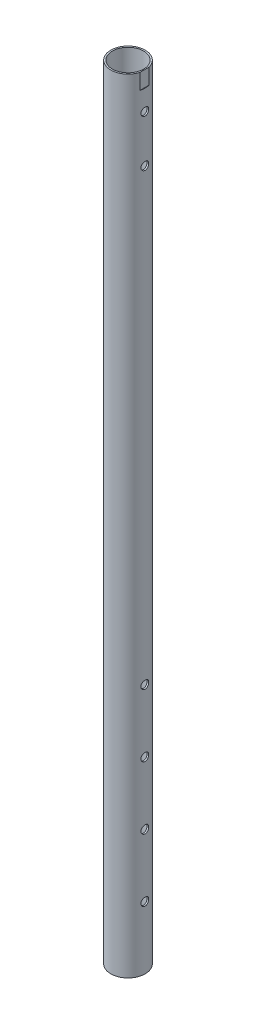
from build123d import *

# Parameters (mm, degrees)
SKETCH1_R               = 11
SKETCH1_R_2             = 10
BOSS_EXTRUDE1_DEPTH     = 500
SKETCH2_W               = 0.79991629
SKETCH2_H               = 5.878473502
CUT_EXTRUDE1_DEPTH      = 10
CUT_EXTRUDE2_DEPTH      = 501.587216984
CUT_EXTRUDE2_DEPTH_BACK = 501.587216984
SKETCH3_R               = 2.5
CUT_EXTRUDE3_DEPTH      = 501.587217091
CUT_EXTRUDE3_DEPTH_BACK = 501.587217091
SKETCH5_R               = 2.5


with BuildPart() as part:
    # Sketch1 → Boss-Extrude1 (new body)
    with BuildSketch(Plane(origin=(0, 0, 0), x_dir=(1, 0, 0), z_dir=(0, 1, 0))):
        with Locations(Location((0, 0, 0), (0, 0, 270))):
            Circle(SKETCH1_R)
        with Locations(Location((0, 0, 0), (0, 0, 270))):
            Circle(SKETCH1_R_2, mode=Mode.SUBTRACT)
    extrude(amount=BOSS_EXTRUDE1_DEPTH)

    # Sketch2 → Cut-Extrude1 (cut)
    with BuildSketch(Plane(origin=(0, 500, 0), x_dir=(1, 0, 0), z_dir=(0, 1, 0))):
        with Locations((11, 0)):
            Rectangle(SKETCH2_W, SKETCH2_H)
    extrude(amount=-CUT_EXTRUDE1_DEPTH, mode=Mode.SUBTRACT)

    # Sketch3 → Cut-Extrude2 (cut, two sides: drawn at the far end of the back side and taken through both)
    with BuildSketch(Plane(origin=(10.600041855, 0, 0), x_dir=(0, 0, -1), z_dir=(1, 0, 0)).offset(-CUT_EXTRUDE2_DEPTH_BACK)):
        with Locations((0, 477)):
            Circle(SKETCH3_R)
        with Locations((0, 447)):
            Circle(SKETCH3_R)
    extrude(amount=CUT_EXTRUDE2_DEPTH + CUT_EXTRUDE2_DEPTH_BACK, mode=Mode.SUBTRACT)

    # Sketch5 → Cut-Extrude3 (cut, two sides: drawn at the far end of the back side and taken through both)
    with BuildSketch(Plane(origin=(10.600041855, 0, 0), x_dir=(0, 0, -1), z_dir=(1, 0, 0)).offset(-CUT_EXTRUDE3_DEPTH_BACK)):
        with Locations((0, 40)):
            Circle(SKETCH5_R)
        with Locations((0, 80)):
            Circle(SKETCH5_R)
        with Locations((0, 120)):
            Circle(SKETCH5_R)
        with Locations((0, 160)):
            Circle(SKETCH5_R)
    extrude(amount=CUT_EXTRUDE3_DEPTH + CUT_EXTRUDE3_DEPTH_BACK, mode=Mode.SUBTRACT)


solid = part.part
